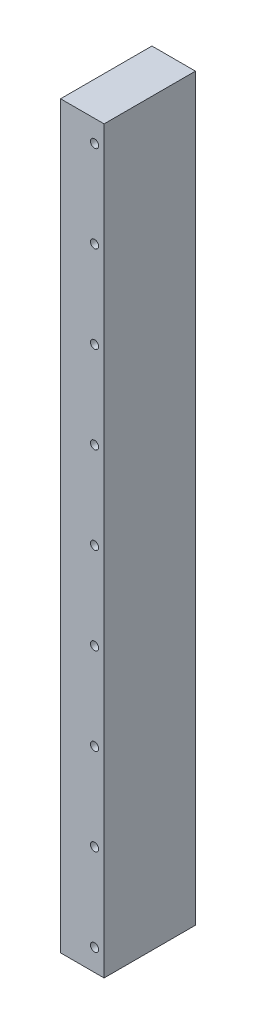
from build123d import *

# Parameters (mm, degrees)
PROFILE_SKETCH_W           = 8
PROFILE_SKETCH_H           = 16.8
PROFILE_EXTRUDE_DEPTH      = 136
INDEX_HOLE_SKETCH_R        = 0.75
FIRST_INDEX_HOLE_CUT_DEPTH = 5
INDEX_HOLE_PATTERN_COUNT   = 9
INDEX_HOLE_PATTERN_PITCH   = 16


with BuildPart() as part:
    # Profile Sketch → Profile Extrude (new body)
    with BuildSketch(Plane(origin=(0.045617437, 0, -0.024209872), x_dir=(-1, 0, 0), z_dir=(0, 1, 0))):
        with Locations((4.045617437, -8.375790128)):
            Rectangle(PROFILE_SKETCH_W, PROFILE_SKETCH_H)
    extrude(amount=PROFILE_EXTRUDE_DEPTH)

    # Index Hole Sketch → First Index Hole Cut (cut)
    with BuildSketch(Plane.XY):
        with Locations((-1.75, 4)):
            Circle(INDEX_HOLE_SKETCH_R)
    first_index_hole_cut = extrude(amount=-FIRST_INDEX_HOLE_CUT_DEPTH, mode=Mode.SUBTRACT)

    # Index Hole Pattern: First Index Hole Cut ×9
    with Locations(*[(0, i * INDEX_HOLE_PATTERN_PITCH, 0) for i in range(1, INDEX_HOLE_PATTERN_COUNT)]):
        add(first_index_hole_cut, mode=Mode.SUBTRACT)


solid = part.part
